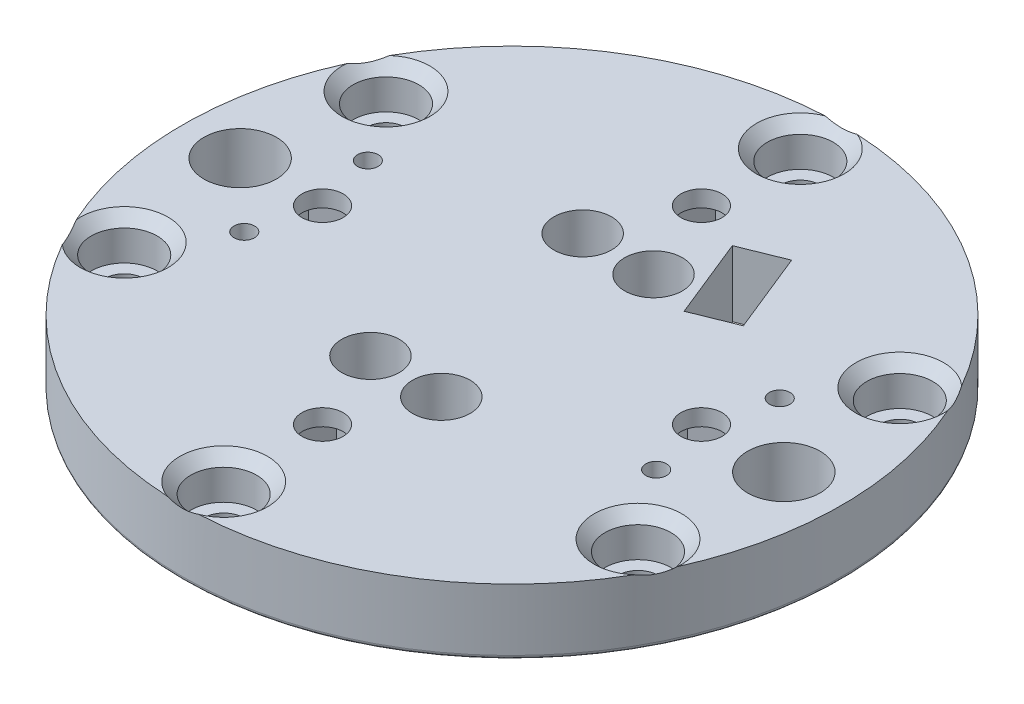
from build123d import *

# Parameters (mm, degrees)
SKETCH1_W                                     = 40
SKETCH1_H                                     = 8
CUT_EXTRUDE1_DEPTH                            = 58.131427428
SKETCH3_W                                     = 13
SKETCH3_H                                     = 2
BOSS_EXTRUDE1_DEPTH                           = 3.5
CUT_EXTRUDE2_DEPTH                            = 6
CUT_EXTRUDE3_DEPTH                            = 6
CUT_EXTRUDE4_DEPTH                            = 6
CUT_EXTRUDE5_DEPTH                            = 6
F_7_0_7_DIAMETER_HOLE1_D                      = 7
F_2_5_2_5_DIAMETER_HOLE1_D                    = 2.5
F_2_5_2_5_DIAMETER_HOLE1_DEPTH                = 11.5
F_8_8_8_8_DIAMETER_HOLE1_D                    = 8.8
F_8_8_8_8_DIAMETER_HOLE1_DEPTH                = 11.5
CBORE_FOR_M4_HEX_HEAD_MACHINE_SCREW1_AT_COUNT = 2
CBORE_FOR_M4_HEX_HEAD_MACHINE_SCREW1_AT_PITCH = 36.57489953
CBORE_FOR_M4_HEX_HEAD_MACHINE_SCREW1_2_COUNT  = 2
CBORE_FOR_M4_HEX_HEAD_MACHINE_SCREW1_2_PITCH  = 62.370456693
CBORE_FOR_M4_HEX_HEAD_MACHINE_SCREW1_3_COUNT  = 2
CBORE_FOR_M4_HEX_HEAD_MACHINE_SCREW1_3_PITCH  = 31.779334982
CBORE_FOR_M4_HEX_HEAD_MACHINE_SCREW1_4_COUNT  = 2
CBORE_FOR_M4_HEX_HEAD_MACHINE_SCREW1_4_PITCH  = 59.684811505
CBORE_FOR_M4_HEX_HEAD_MACHINE_SCREW1_5_COUNT  = 2
CBORE_FOR_M4_HEX_HEAD_MACHINE_SCREW1_5_PITCH  = 70
F_5_0_5_DIAMETER_HOLE1_D                      = 5
FILLET1_R                                     = 0.5


with BuildPart() as part:
    # Sketch1 → Revolve1 (revolve)
    with BuildSketch(Plane.XY, mode=Mode.PRIVATE) as revolve1_sk:
        with Locations((20, 4)):
            Rectangle(SKETCH1_W, SKETCH1_H)
    revolve(revolve1_sk.sketch.rotate(Axis((0, 8, 0), (0, -1, 0)), 270), axis=Axis((0, 8, 0), (0, -1, 0)))

    # Sketch2 → Cut-Extrude1 (cut, through all)
    with BuildSketch(Plane(origin=(0, 8, 0), x_dir=(-1, 0, 0), z_dir=(0, 1, 0))):
        Polygon((-6.069687354, -20.679550025), (-10.040517244, -10.851401166), (-15.163753313, -12.921322899), (-11.192923423, -22.749471758), align=None)
    extrude(amount=-CUT_EXTRUDE1_DEPTH, mode=Mode.SUBTRACT)

    # Sketch3 → Boss-Extrude1 (add)
    with BuildSketch(Plane.XZ):
        Rectangle(SKETCH3_W, SKETCH3_H)
    extrude(amount=BOSS_EXTRUDE1_DEPTH)

    # Sketch4 → Cut-Extrude2 (cut)
    with BuildSketch(Plane.XZ):
        Polygon((-2.29496732, 26.975), (-4.58993464, 23), (-2.29496732, 19.025), (2.29496732, 19.025), (4.58993464, 23), (2.29496732, 26.975), align=None)
    extrude(amount=-CUT_EXTRUDE2_DEPTH, mode=Mode.SUBTRACT)

    # Sketch5 → Cut-Extrude3 (cut)
    with BuildSketch(Plane.XZ):
        Polygon((-26.975, -2.29496732), (-23, -4.58993464), (-19.025, -2.29496732), (-19.025, 2.29496732), (-23, 4.58993464), (-26.975, 2.29496732), align=None)
    extrude(amount=-CUT_EXTRUDE3_DEPTH, mode=Mode.SUBTRACT)

    # Sketch6 → Cut-Extrude4 (cut)
    with BuildSketch(Plane.XZ):
        Polygon((2.29496732, -26.975), (4.58993464, -23), (2.29496732, -19.025), (-2.29496732, -19.025), (-4.58993464, -23), (-2.29496732, -26.975), align=None)
    extrude(amount=-CUT_EXTRUDE4_DEPTH, mode=Mode.SUBTRACT)

    # Sketch7 → Cut-Extrude5 (cut)
    with BuildSketch(Plane.XZ):
        Polygon((26.975, 2.29496732), (23, 4.58993464), (19.025, 2.29496732), (19.025, -2.29496732), (23, -4.58993464), (26.975, -2.29496732), align=None)
    extrude(amount=-CUT_EXTRUDE5_DEPTH, mode=Mode.SUBTRACT)

    # Ø7.0 (7) Diameter Hole1 (through all)
    with Locations(Plane(origin=(0, 0, 0), x_dir=(-1, 0, 0), z_dir=(0, -1, 0))):
        with Locations((4.3, -12.88), (4.3, 12.88), (-4.3, 12.88), (-4.3, -12.88)):
            Hole(F_7_0_7_DIAMETER_HOLE1_D / 2)

    # Ø2.5 (2.5) Diameter Hole1
    with Locations(Plane(origin=(0, 8, 0), x_dir=(1, 0, 0), z_dir=(0, 1, 0))):
        with Locations((25, -7.5), (25, 7.5), (-25, 7.5), (-25, -7.5)):
            Hole(F_2_5_2_5_DIAMETER_HOLE1_D / 2, depth=F_2_5_2_5_DIAMETER_HOLE1_DEPTH)

    # Ø8.8 (8.8) Diameter Hole1
    with Locations(Plane(origin=(0, 8, 0), x_dir=(1, 0, 0), z_dir=(0, 1, 0))):
        with Locations((33, 0), (-33, 0)):
            Hole(F_8_8_8_8_DIAMETER_HOLE1_D / 2, depth=F_8_8_8_8_DIAMETER_HOLE1_DEPTH)

    # Sketch14 → CBORE for M4 Hex Head Machine Screw1 (revolve, cut)
    with BuildSketch(Plane(origin=(-31.185228347, 8, 15.889667491), x_dir=(0, 0, 1), z_dir=(1, 0, 0))):
        Polygon((0, 0), (0, 11.5), (2.4, 11.5), (2.4, 5), (4, 5), (4, 1.32), (5.32, 0), align=None)
    cbore_for_m4_hex_head_machine_screw1 = revolve(axis=Axis((-31.185228347, 14.35, 15.889667491), (0, -1, 0)), mode=Mode.SUBTRACT)

    # CBORE for M4 Hex Head Machine Screw1 at: CBORE for M4 Hex Head Machine Screw1 ×2
    with Locations(*[Vector(0.8526401643540931, 0, 0.5224985647159477) * (i * CBORE_FOR_M4_HEX_HEAD_MACHINE_SCREW1_AT_PITCH) for i in range(1, CBORE_FOR_M4_HEX_HEAD_MACHINE_SCREW1_AT_COUNT)]):
        add(cbore_for_m4_hex_head_machine_screw1, mode=Mode.SUBTRACT)

    # CBORE for M4 Hex Head Machine Screw1 2: CBORE for M4 Hex Head Machine Screw1 ×2
    with Locations(*[(i * CBORE_FOR_M4_HEX_HEAD_MACHINE_SCREW1_2_PITCH, 0, 0) for i in range(1, CBORE_FOR_M4_HEX_HEAD_MACHINE_SCREW1_2_COUNT)]):
        add(cbore_for_m4_hex_head_machine_screw1, mode=Mode.SUBTRACT)

    # CBORE for M4 Hex Head Machine Screw1 3: CBORE for M4 Hex Head Machine Screw1 ×2
    with Locations(*[(0, 0, -i * CBORE_FOR_M4_HEX_HEAD_MACHINE_SCREW1_3_PITCH) for i in range(1, CBORE_FOR_M4_HEX_HEAD_MACHINE_SCREW1_3_COUNT)]):
        add(cbore_for_m4_hex_head_machine_screw1, mode=Mode.SUBTRACT)

    # CBORE for M4 Hex Head Machine Screw1 4: CBORE for M4 Hex Head Machine Screw1 ×2
    with Locations(*[Vector(0.5224985647159471, 0, -0.8526401643540933) * (i * CBORE_FOR_M4_HEX_HEAD_MACHINE_SCREW1_4_PITCH) for i in range(1, CBORE_FOR_M4_HEX_HEAD_MACHINE_SCREW1_4_COUNT)]):
        add(cbore_for_m4_hex_head_machine_screw1, mode=Mode.SUBTRACT)

    # CBORE for M4 Hex Head Machine Screw1 5: CBORE for M4 Hex Head Machine Screw1 ×2
    with Locations(*[Vector(0.8910065241883662, 0, -0.45399049973955025) * (i * CBORE_FOR_M4_HEX_HEAD_MACHINE_SCREW1_5_PITCH) for i in range(1, CBORE_FOR_M4_HEX_HEAD_MACHINE_SCREW1_5_COUNT)]):
        add(cbore_for_m4_hex_head_machine_screw1, mode=Mode.SUBTRACT)

    # Ø5.0 (5) Diameter Hole1 (through all)
    with Locations(Plane(origin=(0, 6, 0), x_dir=(-1, 0, 0), z_dir=(0, -1, 0))):
        with Locations((-23, 0), (0, 23), (23, 0), (0, -23)):
            Hole(F_5_0_5_DIAMETER_HOLE1_D / 2)

    # Fillet1
    fillet1_edges = [part.edges().sort_by_distance(p)[0] for p in [
        (0, 0, 40),
    ]]
    fillet(fillet1_edges, radius=FILLET1_R)


solid = part.part
